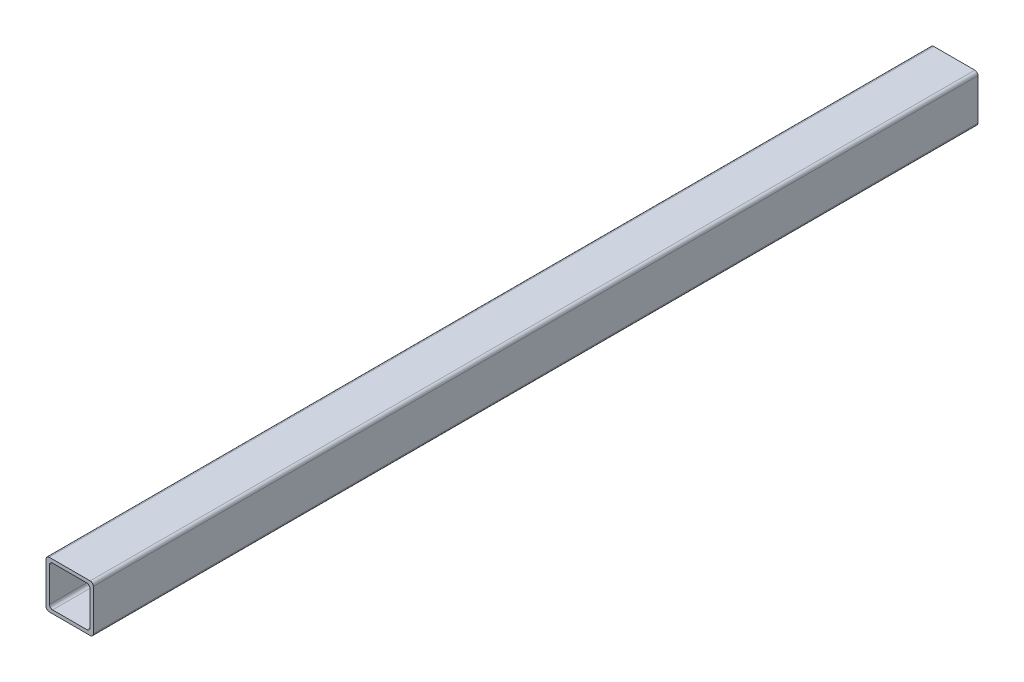
from build123d import *

# Parameters (mm, degrees)
BOSS_EXTRUDE1_DEPTH = 737
SKETCH2_W           = 38.1
SKETCH2_H           = 25.1
CUT_EXTRUDE1_DEPTH  = 739.966995203


with BuildPart() as part:
    # Sketch1 → Boss-Extrude1 (new body)
    with BuildSketch(Plane.XY):
        with BuildLine():
            Line((2.54, 0), (35.56, 0))
            ThreePointArc((35.56, 0), (37.356051224, -0.743948776), (38.1, -2.54))
            Line((38.1, -2.54), (38.1, -35.56))
            ThreePointArc((38.1, -35.56), (37.356051224, -37.356051224), (35.56, -38.1))
            Line((35.56, -38.1), (2.54, -38.1))
            ThreePointArc((2.54, -38.1), (0.743948776, -37.356051224), (0, -35.56))
            Line((0, -35.56), (0, -2.54))
            ThreePointArc((0, -2.54), (0.743948776, -0.743948776), (2.54, 0))
        make_face()
        with BuildLine():
            Line((5.3086, -2.7686), (32.7914, -2.7686))
            ThreePointArc((32.7914, -2.7686), (34.587451224, -3.512548776), (35.3314, -5.3086))
            Line((35.3314, -5.3086), (35.3314, -32.7914))
            ThreePointArc((35.3314, -32.7914), (34.587451224, -34.587451224), (32.7914, -35.3314))
            Line((32.7914, -35.3314), (5.3086, -35.3314))
            ThreePointArc((5.3086, -35.3314), (3.512548776, -34.587451224), (2.7686, -32.7914))
            Line((2.7686, -32.7914), (2.7686, -5.3086))
            ThreePointArc((2.7686, -5.3086), (3.512548776, -3.512548776), (5.3086, -2.7686))
        make_face(mode=Mode.SUBTRACT)
    extrude(amount=BOSS_EXTRUDE1_DEPTH)

    # Sketch2 → Cut-Extrude1 (cut, through all)
    with BuildSketch(Plane(origin=(0, 0, 0), x_dir=(1, 0, 0), z_dir=(0, 1, 0))):
        with Locations((19.05, -724.45)):
            Rectangle(SKETCH2_W, SKETCH2_H)
    extrude(amount=-CUT_EXTRUDE1_DEPTH, mode=Mode.SUBTRACT)


solid = part.part
